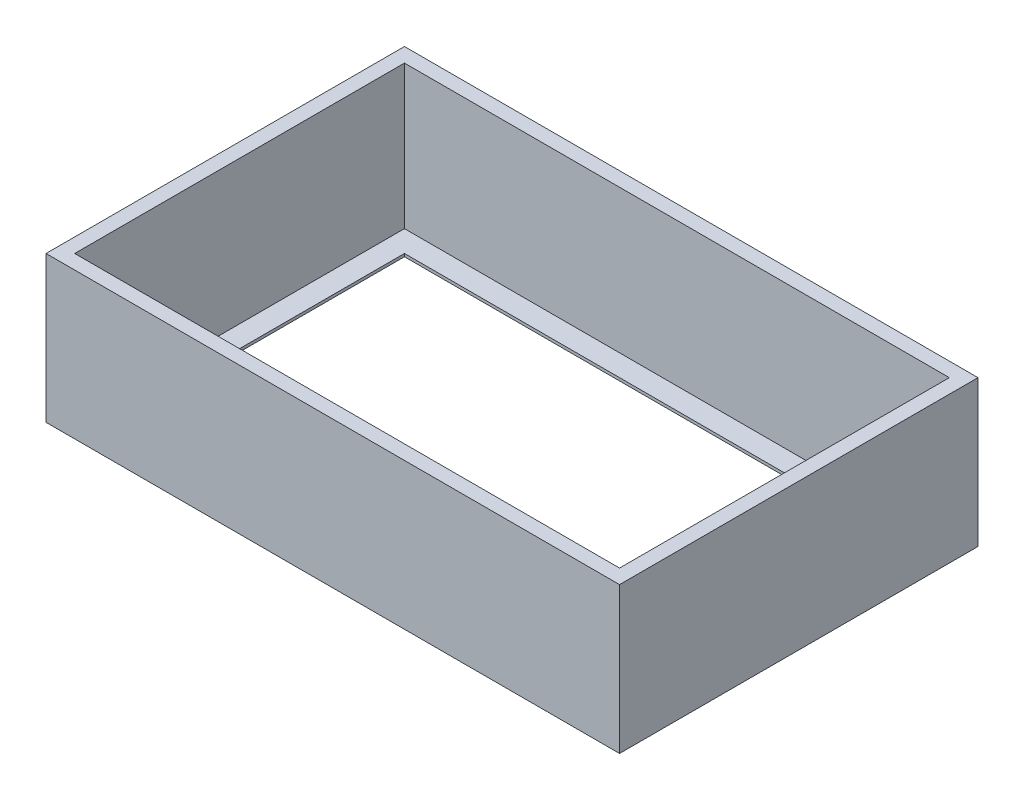
from build123d import *

# Parameters (mm, degrees)
SKETCH1_W           = 80
SKETCH1_H           = 50
BOSS_EXTRUDE1_DEPTH = 0.4
SKETCH2_W           = 80
SKETCH2_H           = 50
SKETCH2_W_2         = 76
SKETCH2_H_2         = 46
BOSS_EXTRUDE2_DEPTH = 20
SKETCH3_W           = 70
SKETCH3_H           = 40
CUT_EXTRUDE1_DEPTH  = 98.729539691


with BuildPart() as part:
    # Sketch1 → Boss-Extrude1 (new body)
    with BuildSketch(Plane(origin=(0, 0, 0), x_dir=(1, 0, 0), z_dir=(0, 1, 0))):
        with Locations((40.973770478, -25.775500222)):
            Rectangle(SKETCH1_W, SKETCH1_H)
    extrude(amount=BOSS_EXTRUDE1_DEPTH)

    # Sketch2 → Boss-Extrude2 (add)
    with BuildSketch(Plane(origin=(0, 0.4, 0), x_dir=(1, 0, 0), z_dir=(0, 1, 0))):
        with Locations((40.973770478, -25.775500222)):
            Rectangle(SKETCH2_W, SKETCH2_H)
        with Locations((40.973770478, -25.775500222)):
            Rectangle(SKETCH2_W_2, SKETCH2_H_2, mode=Mode.SUBTRACT)
    extrude(amount=BOSS_EXTRUDE2_DEPTH)

    # Sketch3 → Cut-Extrude1 (cut, through all)
    with BuildSketch(Plane(origin=(0, 0, 0), x_dir=(-1, 0, 0), z_dir=(0, -1, 0))):
        with Locations((-40.973770478, -25.775500222)):
            Rectangle(SKETCH3_W, SKETCH3_H)
    extrude(amount=-CUT_EXTRUDE1_DEPTH, mode=Mode.SUBTRACT)


solid = part.part
